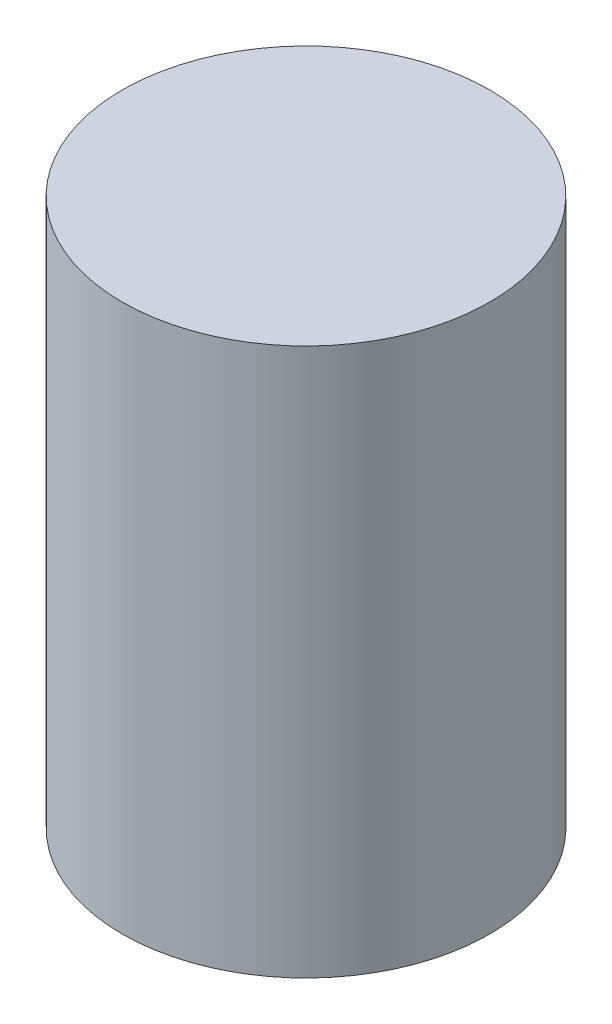
from build123d import *

# Parameters (mm, degrees)
SKETCH1_R           = 2.35
BOSS_EXTRUDE1_DEPTH = 7


with BuildPart() as part:
    # Sketch1 → Boss-Extrude1 (new body)
    with BuildSketch(Plane(origin=(0, 0, 0), x_dir=(1, 0, 0), z_dir=(0, 1, 0))):
        with Locations(Location((0, 0, 0), (0, 0, 270))):
            Circle(SKETCH1_R)
    extrude(amount=BOSS_EXTRUDE1_DEPTH)


solid = part.part
